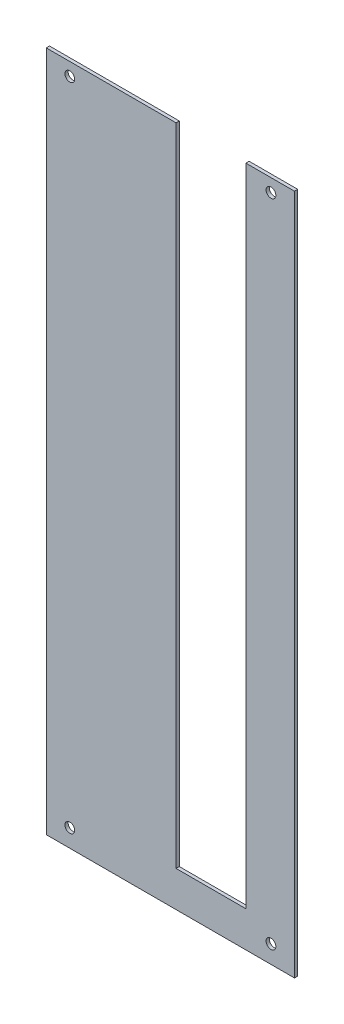
from build123d import *

# Parameters (mm, degrees)
SKETCH1_W           = 153
SKETCH1_H           = 420
BOSS_EXTRUDE1_DEPTH = 2
CUT_EXTRUDE1_REACH  = 225.509
SKETCH2_W           = 43
SKETCH2_H           = 398
CUT_EXTRUDE2_REACH  = 225.509
SKETCH3_R           = 3


with BuildPart() as part:
    # Sketch1 → Boss-Extrude1 (new body)
    with BuildSketch(Plane.XY):
        Rectangle(SKETCH1_W, SKETCH1_H)
    extrude(amount=BOSS_EXTRUDE1_DEPTH)

    # Sketch2 → Cut-Extrude1 (cut, up to next)
    with BuildSketch(Plane(origin=(0, 0, 0), x_dir=(-1, 0, 0), z_dir=(0, 0, -1)), mode=Mode.PRIVATE) as cut_extrude1_sk1:
        with Locations((-25, 11)):
            Rectangle(SKETCH2_W, SKETCH2_H)
    cut_extrude1_tool1 = extrude(cut_extrude1_sk1.sketch, amount=-CUT_EXTRUDE1_REACH, mode=Mode.PRIVATE) & part.part
    add(cut_extrude1_tool1.solids().sort_by_distance((25, 11, 0))[0], mode=Mode.SUBTRACT)

    # Sketch3 → Cut-Extrude2 (cut, up to next)
    with BuildSketch(Plane(origin=(0, 0, 0), x_dir=(-1, 0, 0), z_dir=(0, 0, -1)), mode=Mode.PRIVATE) as cut_extrude2_sk1:
        with Locations((-62, 202)):
            Circle(SKETCH3_R)
    cut_extrude2_tool1 = extrude(cut_extrude2_sk1.sketch, amount=-CUT_EXTRUDE2_REACH, mode=Mode.PRIVATE) & part.part
    # Sketch3 → Cut-Extrude2 (cut, up to next)
    with BuildSketch(Plane(origin=(0, 0, 0), x_dir=(-1, 0, 0), z_dir=(0, 0, -1)), mode=Mode.PRIVATE) as cut_extrude2_sk2:
        with Locations((-62, -199)):
            Circle(SKETCH3_R)
    cut_extrude2_tool2 = extrude(cut_extrude2_sk2.sketch, amount=-CUT_EXTRUDE2_REACH, mode=Mode.PRIVATE) & part.part
    # Sketch3 → Cut-Extrude2 (cut, up to next)
    with BuildSketch(Plane(origin=(0, 0, 0), x_dir=(-1, 0, 0), z_dir=(0, 0, -1)), mode=Mode.PRIVATE) as cut_extrude2_sk3:
        with Locations((62, 202)):
            Circle(SKETCH3_R)
    cut_extrude2_tool3 = extrude(cut_extrude2_sk3.sketch, amount=-CUT_EXTRUDE2_REACH, mode=Mode.PRIVATE) & part.part
    # Sketch3 → Cut-Extrude2 (cut, up to next)
    with BuildSketch(Plane(origin=(0, 0, 0), x_dir=(-1, 0, 0), z_dir=(0, 0, -1)), mode=Mode.PRIVATE) as cut_extrude2_sk4:
        with Locations((62, -199)):
            Circle(SKETCH3_R)
    cut_extrude2_tool4 = extrude(cut_extrude2_sk4.sketch, amount=-CUT_EXTRUDE2_REACH, mode=Mode.PRIVATE) & part.part
    add(cut_extrude2_tool1.solids().sort_by_distance((62, 202, 0))[0], mode=Mode.SUBTRACT)
    add(cut_extrude2_tool2.solids().sort_by_distance((62, -199, 0))[0], mode=Mode.SUBTRACT)
    add(cut_extrude2_tool3.solids().sort_by_distance((-62, 202, 0))[0], mode=Mode.SUBTRACT)
    add(cut_extrude2_tool4.solids().sort_by_distance((-62, -199, 0))[0], mode=Mode.SUBTRACT)


solid = part.part
